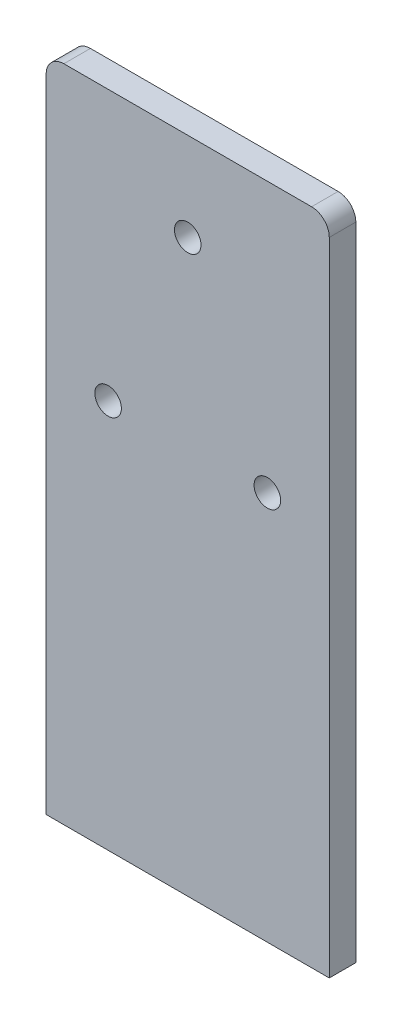
from build123d import *

# Parameters (mm, degrees)
CROQUIS1_W              = 32
CROQUIS1_H              = 74.5
CROQUIS1_R              = 1.5
SALIENTE_EXTRUIR1_DEPTH = 1.5
REDONDEO1_R             = 2


with BuildPart() as part:
    # Croquis1 → Saliente-Extruir1 (new, symmetric)
    with BuildSketch(Plane.XY):
        Rectangle(CROQUIS1_W, CROQUIS1_H)
        with Locations((0, 27.25)):
            Circle(CROQUIS1_R, mode=Mode.SUBTRACT)
        with Locations((-9, 6.75)):
            Circle(CROQUIS1_R, mode=Mode.SUBTRACT)
        with Locations((9, 6.75)):
            Circle(CROQUIS1_R, mode=Mode.SUBTRACT)
    extrude(amount=SALIENTE_EXTRUIR1_DEPTH, both=True)

    # Redondeo1
    redondeo1_edges = [part.edges().sort_by_distance(p)[0] for p in [
        (-16, 37.25, 0),
        (16, 37.25, 0),
    ]]
    fillet(redondeo1_edges, radius=REDONDEO1_R)


solid = part.part
